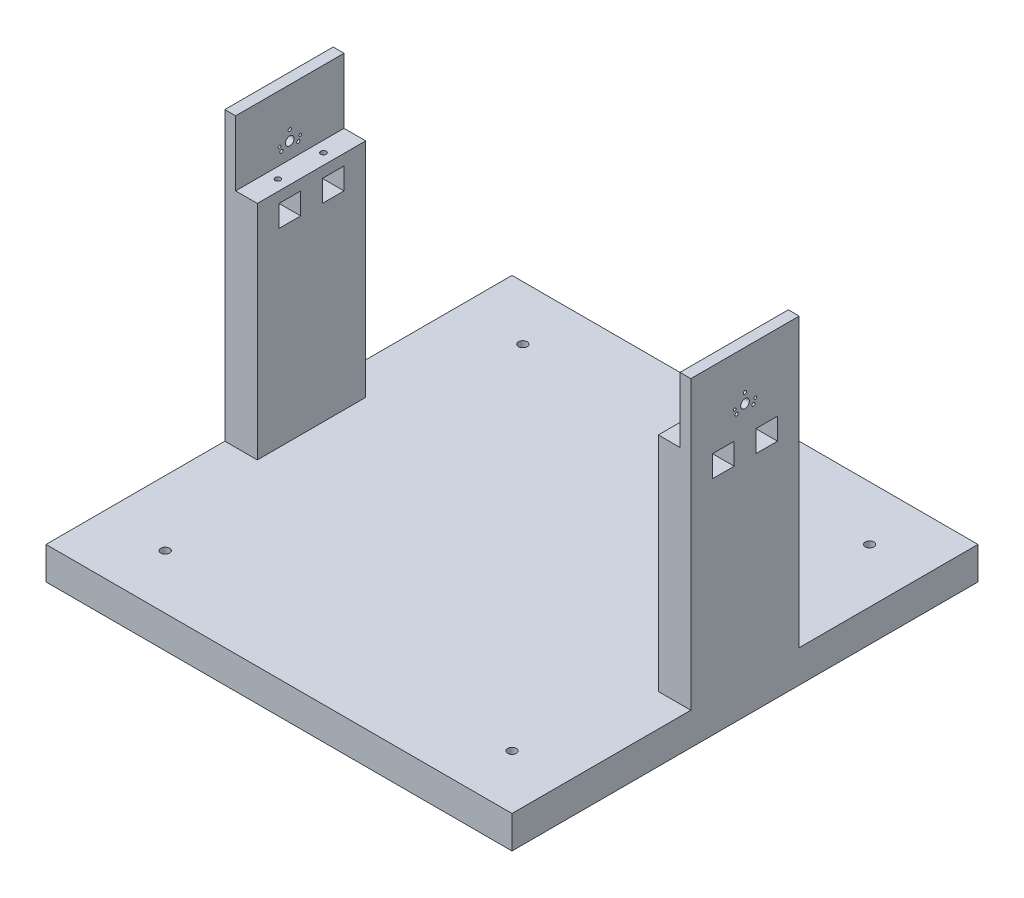
from build123d import *

# Parameters (mm, degrees)
ESBO_O1_W                = 20
ESBO_O1_H                = 430
RESSALTO_EXTRUS_O1_DEPTH = 205
ESBO_O1_3_W              = 390
ESBO_O1_3_H              = 430
ESBO_O1_3_W_2            = 10
RESSALTO_EXTRUS_O2_DEPTH = 30
ESBO_O2_W                = 20
ESBO_O2_H                = 430
RESSALTO_EXTRUS_O4_DEPTH = 30
ESBO_O4_W                = 20
ESBO_O4_H                = 165
CORTE_EXTRUS_O1_DEPTH    = 205
ESBO_O6_R                = 2.5
CORTE_EXTRUS_O3_DEPTH    = 10
RESSALTO_EXTRUS_O6_START = -235
ESBO_O7_W                = 10
ESBO_O7_H                = 100
RESSALTO_EXTRUS_O6_DEPTH = 295
CORTE_EXTRUS_O4_REACH    = 665.344
ESBO_O8_R                = 4
ESBO_O8_R_2              = 1.25
ESBO_O8_R_3              = 1.5
CORTE_EXTRUS_O5_REACH    = 671.571
ESBO_O9_W                = 20
ESBO_O9_H                = 20
CORTE_EXTRUS_O8_REACH    = 671.571
ESBO_O10_R               = 4


with BuildPart() as part:
    # Esboço1 → Ressalto-extrusão1 (new body)
    with BuildSketch(Plane(origin=(0, 0, 0), x_dir=(1, 0, 0), z_dir=(0, 1, 0))):
        with Locations((10, 215)):
            Rectangle(ESBO_O1_W, ESBO_O1_H)
    ressalto_extrus_o1 = extrude(amount=RESSALTO_EXTRUS_O1_DEPTH)

    # Esboço1<3> → Ressalto-extrusão2 (add)
    with BuildSketch(Plane(origin=(0, 0, 0), x_dir=(1, 0, 0), z_dir=(0, 1, 0))):
        with Locations((215, 215)):
            Rectangle(ESBO_O1_3_W, ESBO_O1_3_H)
        with Locations((-5, 215)):
            Rectangle(ESBO_O1_3_W_2, ESBO_O1_3_H)
    ressalto_extrus_o2 = extrude(amount=RESSALTO_EXTRUS_O2_DEPTH)

    # Esboço2 → Ressalto-extrusão4 (add)
    with BuildSketch(Plane(origin=(0, 205, 0), x_dir=(1, 0, 0), z_dir=(0, 1, 0))):
        with Locations((10, 215)):
            Rectangle(ESBO_O2_W, ESBO_O2_H)
    ressalto_extrus_o4 = extrude(amount=RESSALTO_EXTRUS_O4_DEPTH)

    # Esboço4 → Corte-extrusão1 (cut)
    with BuildSketch(Plane(origin=(0, 235, 0), x_dir=(1, 0, 0), z_dir=(0, 1, 0))):
        with Locations((10, 347.5)):
            Rectangle(ESBO_O4_W, ESBO_O4_H)
        with Locations((10, 82.5)):
            Rectangle(ESBO_O4_W, ESBO_O4_H)
    corte_extrus_o1 = extrude(amount=-CORTE_EXTRUS_O1_DEPTH, mode=Mode.SUBTRACT)

    # Esboço6 → Corte-extrusão3 (cut)
    with BuildSketch(Plane(origin=(0, 235, 0), x_dir=(1, 0, 0), z_dir=(0, 1, 0))):
        with Locations(Location((10, 236, 0), (0, 0, 270))):
            Circle(ESBO_O6_R)
        with Locations(Location((10, 194, 0), (0, 0, 270))):
            Circle(ESBO_O6_R)
    corte_extrus_o3 = extrude(amount=-CORTE_EXTRUS_O3_DEPTH, mode=Mode.SUBTRACT)

    # Esboço7 → Ressalto-extrusão6 (add)
    with BuildSketch(Plane(origin=(0, 235, 0), x_dir=(1, 0, 0), z_dir=(0, 1, 0)).offset(RESSALTO_EXTRUS_O6_START)):
        with Locations((-5, 215)):
            Rectangle(ESBO_O7_W, ESBO_O7_H)
    ressalto_extrus_o6 = extrude(amount=RESSALTO_EXTRUS_O6_DEPTH)

    # Esboço8 → Corte-extrusão4 (cut, up to next)
    with BuildSketch(Plane(origin=(0, 0, 0), x_dir=(0, 0, -1), z_dir=(1, 0, 0)), mode=Mode.PRIVATE) as corte_extrus_o4_sk1:
        with Locations((215, 250)):
            Circle(ESBO_O8_R)
    corte_extrus_o4_tool1 = extrude(corte_extrus_o4_sk1.sketch, amount=-CORTE_EXTRUS_O4_REACH, mode=Mode.PRIVATE) & part.part
    # Esboço8 → Corte-extrusão4 (cut, up to next)
    with BuildSketch(Plane(origin=(0, 0, 0), x_dir=(0, 0, -1), z_dir=(1, 0, 0)), mode=Mode.PRIVATE) as corte_extrus_o4_sk2:
        with Locations((205.47, 250)):
            Circle(ESBO_O8_R_2)
    corte_extrus_o4_tool2 = extrude(corte_extrus_o4_sk2.sketch, amount=-CORTE_EXTRUS_O4_REACH, mode=Mode.PRIVATE) & part.part
    # Esboço8 → Corte-extrusão4 (cut, up to next)
    with BuildSketch(Plane(origin=(0, 0, 0), x_dir=(0, 0, -1), z_dir=(1, 0, 0)), mode=Mode.PRIVATE) as corte_extrus_o4_sk3:
        with Locations((224.53, 250)):
            Circle(ESBO_O8_R_2)
    corte_extrus_o4_tool3 = extrude(corte_extrus_o4_sk3.sketch, amount=-CORTE_EXTRUS_O4_REACH, mode=Mode.PRIVATE) & part.part
    # Esboço8 → Corte-extrusão4 (cut, up to next)
    with BuildSketch(Plane(origin=(0, 0, 0), x_dir=(0, 0, -1), z_dir=(1, 0, 0)), mode=Mode.PRIVATE) as corte_extrus_o4_sk4:
        with Locations((215, 259)):
            Circle(ESBO_O8_R_3)
    corte_extrus_o4_tool4 = extrude(corte_extrus_o4_sk4.sketch, amount=-CORTE_EXTRUS_O4_REACH, mode=Mode.PRIVATE) & part.part
    # Esboço8 → Corte-extrusão4 (cut, up to next)
    with BuildSketch(Plane(origin=(0, 0, 0), x_dir=(0, 0, -1), z_dir=(1, 0, 0)), mode=Mode.PRIVATE) as corte_extrus_o4_sk5:
        with Locations((207.205771366, 245.5)):
            Circle(ESBO_O8_R_3)
    corte_extrus_o4_tool5 = extrude(corte_extrus_o4_sk5.sketch, amount=-CORTE_EXTRUS_O4_REACH, mode=Mode.PRIVATE) & part.part
    # Esboço8 → Corte-extrusão4 (cut, up to next)
    with BuildSketch(Plane(origin=(0, 0, 0), x_dir=(0, 0, -1), z_dir=(1, 0, 0)), mode=Mode.PRIVATE) as corte_extrus_o4_sk6:
        with Locations((222.794228634, 245.5)):
            Circle(ESBO_O8_R_3)
    corte_extrus_o4_tool6 = extrude(corte_extrus_o4_sk6.sketch, amount=-CORTE_EXTRUS_O4_REACH, mode=Mode.PRIVATE) & part.part
    corte_extrus_o4_1 = corte_extrus_o4_tool1.solids().sort_by_distance((0, 250, -215))[0]
    add(corte_extrus_o4_1, mode=Mode.SUBTRACT)
    corte_extrus_o4_2 = corte_extrus_o4_tool2.solids().sort_by_distance((0, 250, -205.47))[0]
    add(corte_extrus_o4_2, mode=Mode.SUBTRACT)
    corte_extrus_o4_3 = corte_extrus_o4_tool3.solids().sort_by_distance((0, 250, -224.53))[0]
    add(corte_extrus_o4_3, mode=Mode.SUBTRACT)
    corte_extrus_o4_4 = corte_extrus_o4_tool4.solids().sort_by_distance((0, 259, -215))[0]
    add(corte_extrus_o4_4, mode=Mode.SUBTRACT)
    corte_extrus_o4_5 = corte_extrus_o4_tool5.solids().sort_by_distance((0, 245.5, -207.205771))[0]
    add(corte_extrus_o4_5, mode=Mode.SUBTRACT)
    corte_extrus_o4_6 = corte_extrus_o4_tool6.solids().sort_by_distance((0, 245.5, -222.794229))[0]
    add(corte_extrus_o4_6, mode=Mode.SUBTRACT)
    corte_extrus_o4 = corte_extrus_o4_1 + corte_extrus_o4_2 + corte_extrus_o4_3 + corte_extrus_o4_4 + corte_extrus_o4_5 + corte_extrus_o4_6  # Corte-extrusão4 as one shape, for the pattern or mirror that repeats it

    # Esboço9 → Corte-extrusão5 (cut, up to next)
    with BuildSketch(Plane.ZY.offset(10), mode=Mode.PRIVATE) as corte_extrus_o5_sk1:
        with Locations((-235, 215)):
            Rectangle(ESBO_O9_W, ESBO_O9_H)
    corte_extrus_o5_tool1 = extrude(corte_extrus_o5_sk1.sketch, amount=-CORTE_EXTRUS_O5_REACH, mode=Mode.PRIVATE) & part.part
    # Esboço9 → Corte-extrusão5 (cut, up to next)
    with BuildSketch(Plane.ZY.offset(10), mode=Mode.PRIVATE) as corte_extrus_o5_sk2:
        with Locations((-195, 215)):
            Rectangle(ESBO_O9_W, ESBO_O9_H)
    corte_extrus_o5_tool2 = extrude(corte_extrus_o5_sk2.sketch, amount=-CORTE_EXTRUS_O5_REACH, mode=Mode.PRIVATE) & part.part
    corte_extrus_o5_1 = corte_extrus_o5_tool1.solids().sort_by_distance((-10, 215, -235))[0]
    add(corte_extrus_o5_1, mode=Mode.SUBTRACT)
    corte_extrus_o5_2 = corte_extrus_o5_tool2.solids().sort_by_distance((-10, 215, -195))[0]
    add(corte_extrus_o5_2, mode=Mode.SUBTRACT)
    corte_extrus_o5 = corte_extrus_o5_1 + corte_extrus_o5_2  # Corte-extrusão5 as one shape, for the pattern or mirror that repeats it

    # Espelhar1: Ressalto-extrusão1, Ressalto-extrusão2, Ressalto-extrusão4, Corte-extrusão1, Corte-extrusão3, Ressalto-extrusão6, Corte-extrusão4, Corte-extrusão5 across plane
    add(ressalto_extrus_o1.mirror(Plane(origin=(205, 0, 0), x_dir=(0, 0, 1), z_dir=(1, 0, 0))))
    add(ressalto_extrus_o2.mirror(Plane(origin=(205, 0, 0), x_dir=(0, 0, 1), z_dir=(1, 0, 0))))
    add(ressalto_extrus_o4.mirror(Plane(origin=(205, 0, 0), x_dir=(0, 0, 1), z_dir=(1, 0, 0))))
    add(corte_extrus_o1.mirror(Plane(origin=(205, 0, 0), x_dir=(0, 0, 1), z_dir=(1, 0, 0))), mode=Mode.SUBTRACT)
    add(corte_extrus_o3.mirror(Plane(origin=(205, 0, 0), x_dir=(0, 0, 1), z_dir=(1, 0, 0))), mode=Mode.SUBTRACT)
    add(ressalto_extrus_o6.mirror(Plane(origin=(205, 0, 0), x_dir=(0, 0, 1), z_dir=(1, 0, 0))))
    add(corte_extrus_o4.mirror(Plane(origin=(205, 0, 0), x_dir=(0, 0, 1), z_dir=(1, 0, 0))), mode=Mode.SUBTRACT)
    add(corte_extrus_o5.mirror(Plane(origin=(205, 0, 0), x_dir=(0, 0, 1), z_dir=(1, 0, 0))), mode=Mode.SUBTRACT)

    # Esboço10 → Corte-extrusão8 (cut, up to next)
    with BuildSketch(Plane(origin=(0, 0, 0), x_dir=(-1, 0, 0), z_dir=(0, -1, 0)), mode=Mode.PRIVATE) as corte_extrus_o8_sk1:
        with Locations(Location((-50, 380, 0), (0, 0, 90))):
            Circle(ESBO_O10_R)
    corte_extrus_o8_tool1 = extrude(corte_extrus_o8_sk1.sketch, amount=-CORTE_EXTRUS_O8_REACH, mode=Mode.PRIVATE) & part.part
    # Esboço10 → Corte-extrusão8 (cut, up to next)
    with BuildSketch(Plane(origin=(0, 0, 0), x_dir=(-1, 0, 0), z_dir=(0, -1, 0)), mode=Mode.PRIVATE) as corte_extrus_o8_sk2:
        with Locations(Location((-50, 50, 0), (0, 0, 90))):
            Circle(ESBO_O10_R)
    corte_extrus_o8_tool2 = extrude(corte_extrus_o8_sk2.sketch, amount=-CORTE_EXTRUS_O8_REACH, mode=Mode.PRIVATE) & part.part
    # Esboço10 → Corte-extrusão8 (cut, up to next)
    with BuildSketch(Plane(origin=(0, 0, 0), x_dir=(-1, 0, 0), z_dir=(0, -1, 0)), mode=Mode.PRIVATE) as corte_extrus_o8_sk3:
        with Locations(Location((-370, 50, 0), (0, 0, 90))):
            Circle(ESBO_O10_R)
    corte_extrus_o8_tool3 = extrude(corte_extrus_o8_sk3.sketch, amount=-CORTE_EXTRUS_O8_REACH, mode=Mode.PRIVATE) & part.part
    # Esboço10 → Corte-extrusão8 (cut, up to next)
    with BuildSketch(Plane(origin=(0, 0, 0), x_dir=(-1, 0, 0), z_dir=(0, -1, 0)), mode=Mode.PRIVATE) as corte_extrus_o8_sk4:
        with Locations(Location((-370, 380, 0), (0, 0, 90))):
            Circle(ESBO_O10_R)
    corte_extrus_o8_tool4 = extrude(corte_extrus_o8_sk4.sketch, amount=-CORTE_EXTRUS_O8_REACH, mode=Mode.PRIVATE) & part.part
    add(corte_extrus_o8_tool1.solids().sort_by_distance((50, 0, -380))[0], mode=Mode.SUBTRACT)
    add(corte_extrus_o8_tool2.solids().sort_by_distance((50, 0, -50))[0], mode=Mode.SUBTRACT)
    add(corte_extrus_o8_tool3.solids().sort_by_distance((370, 0, -50))[0], mode=Mode.SUBTRACT)
    add(corte_extrus_o8_tool4.solids().sort_by_distance((370, 0, -380))[0], mode=Mode.SUBTRACT)


solid = part.part
